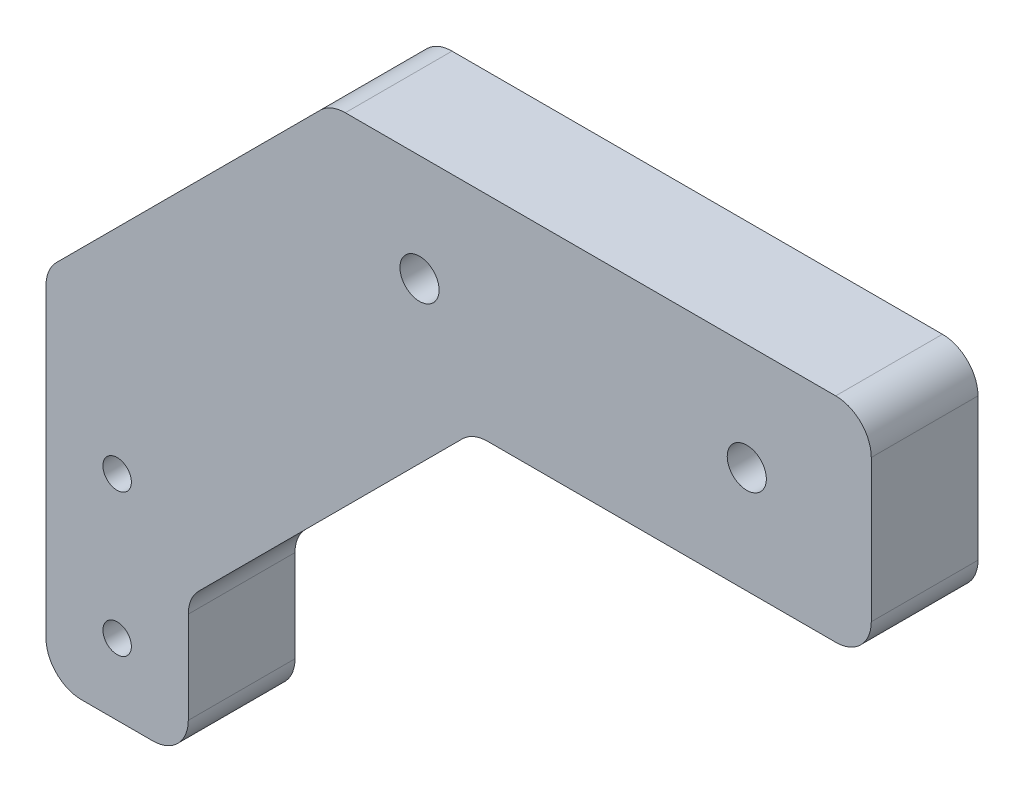
from build123d import *

# Parameters (mm, degrees)
BOSS_EXTRUDE1_DEPTH = 15
CUT_EXTRUDE3_REACH  = 133.457
SKETCH2_R           = 2
SKETCH2_R_2         = 2.75
CHAMFER1_SIZE       = 40
FILLET1_R           = 5


with BuildPart() as part:
    # Sketch1 → Boss-Extrude1 (new body)
    with BuildSketch(Plane.XY):
        Polygon((0, -60), (0, 30), (116, 30), (116, 0), (20, 0), (20, -60), align=None)
    extrude(amount=BOSS_EXTRUDE1_DEPTH)

    # Sketch2 → Cut-Extrude3 (cut, up to next)
    with BuildSketch(Plane.XY, mode=Mode.PRIVATE) as cut_extrude3_sk1:
        with Locations(Location((10, -50, 0), (0, 0, 180))):
            Circle(SKETCH2_R)
    cut_extrude3_tool1 = extrude(cut_extrude3_sk1.sketch, amount=CUT_EXTRUDE3_REACH, mode=Mode.PRIVATE) & part.part
    # Sketch2 → Cut-Extrude3 (cut, up to next)
    with BuildSketch(Plane.XY, mode=Mode.PRIVATE) as cut_extrude3_sk2:
        with Locations(Location((10, -30, 0), (0, 0, 180))):
            Circle(SKETCH2_R)
    cut_extrude3_tool2 = extrude(cut_extrude3_sk2.sketch, amount=CUT_EXTRUDE3_REACH, mode=Mode.PRIVATE) & part.part
    # Sketch2 → Cut-Extrude3 (cut, up to next)
    with BuildSketch(Plane.XY, mode=Mode.PRIVATE) as cut_extrude3_sk3:
        with Locations(Location((52.5, 15, 0), (0, 0, 180))):
            Circle(SKETCH2_R_2)
    cut_extrude3_tool3 = extrude(cut_extrude3_sk3.sketch, amount=CUT_EXTRUDE3_REACH, mode=Mode.PRIVATE) & part.part
    # Sketch2 → Cut-Extrude3 (cut, up to next)
    with BuildSketch(Plane.XY, mode=Mode.PRIVATE) as cut_extrude3_sk4:
        with Locations(Location((98.5, 15, 0), (0, 0, 180))):
            Circle(SKETCH2_R_2)
    cut_extrude3_tool4 = extrude(cut_extrude3_sk4.sketch, amount=CUT_EXTRUDE3_REACH, mode=Mode.PRIVATE) & part.part
    add(cut_extrude3_tool1.solids().sort_by_distance((10, -50, 0))[0], mode=Mode.SUBTRACT)
    add(cut_extrude3_tool2.solids().sort_by_distance((10, -30, 0))[0], mode=Mode.SUBTRACT)
    add(cut_extrude3_tool3.solids().sort_by_distance((52.5, 15, 0))[0], mode=Mode.SUBTRACT)
    add(cut_extrude3_tool4.solids().sort_by_distance((98.5, 15, 0))[0], mode=Mode.SUBTRACT)

    # Chamfer1
    chamfer1_edges = [part.edges().sort_by_distance(p)[0] for p in [
        (0, 30, 7.5),
        (20, 0, 7.5),
    ]]
    chamfer(chamfer1_edges, length=CHAMFER1_SIZE)

    # Fillet1
    fillet1_edges = [part.edges().sort_by_distance(p)[0] for p in [
        (0, -60, 7.5),
        (116, 30, 7.5),
        (116, 0, 7.5),
        (20, -60, 7.5),
        (0, -10, 7.5),
        (40, 30, 7.5),
        (60, 0, 7.5),
        (20, -40, 7.5),
    ]]
    fillet(fillet1_edges, radius=FILLET1_R)


solid = part.part
